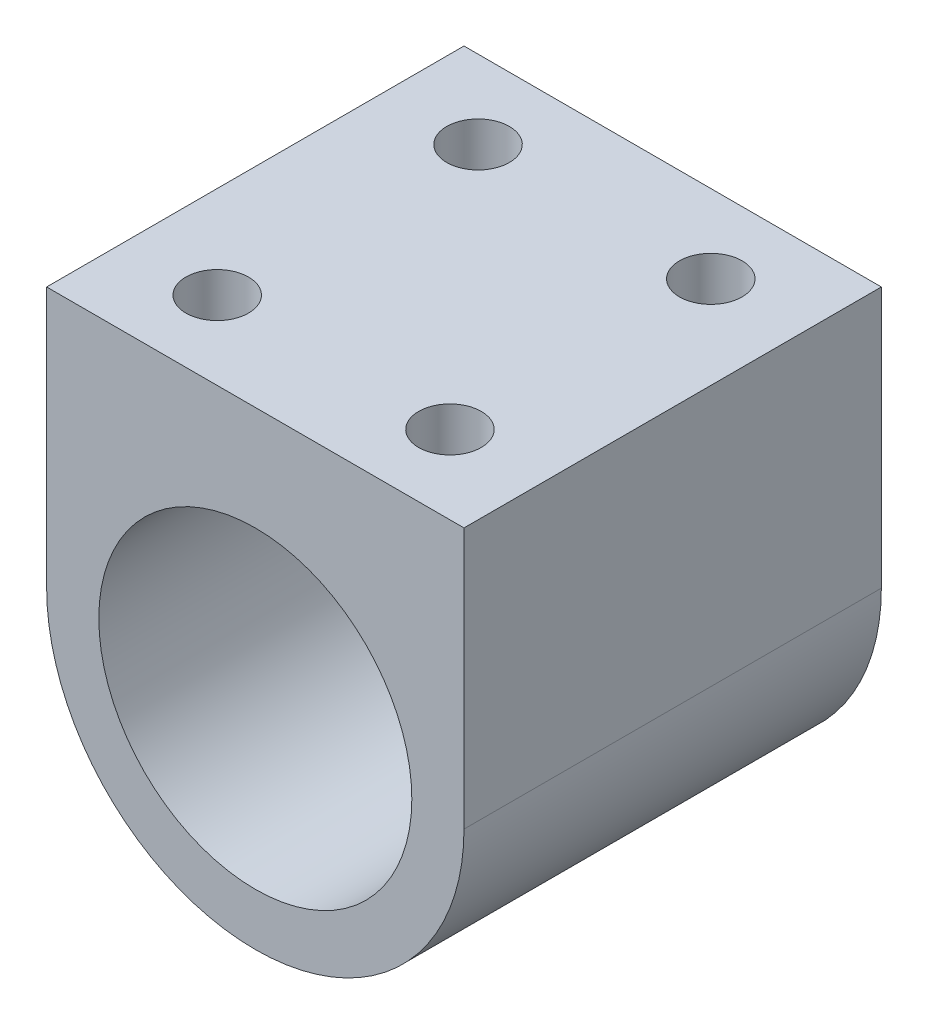
from build123d import *

# Parameters (mm, degrees)
EXTRUDE_1_DEPTH     = 40
SKETCH_2_R          = 15
CUT_EXTRUDE_1_DEPTH = 35
SKETCH_3_R          = 3
CUT_EXTRUDE_2_DEPTH = 12


with BuildPart() as part:
    # 草图1 → 凸台-拉伸1 (new body)
    with BuildSketch(Plane.XY):
        with BuildLine():
            Line((20, 25), (-20, 25))
            Line((-20, 25), (-20, 0))
            ThreePointArc((-20, 0), (0, -20), (20, 0))
            Line((20, 0), (20, 25))
        make_face()
    extrude(amount=EXTRUDE_1_DEPTH)

    # 草图2 → 切除-拉伸1 (cut)
    with BuildSketch(Plane.XY.offset(40)):
        Circle(SKETCH_2_R)
    extrude(amount=-CUT_EXTRUDE_1_DEPTH, mode=Mode.SUBTRACT)

    # 草图3 → 切除-拉伸2 (cut)
    with BuildSketch(Plane(origin=(0, 25, 0), x_dir=(1, 0, 0), z_dir=(0, 1, 0))):
        with Locations(Location((11.153964198, -7.5, 0), (0, 0, 270))):
            Circle(SKETCH_3_R)
        with Locations(Location((-11.153964198, -7.5, 0), (0, 0, 90))):
            Circle(SKETCH_3_R)
        with Locations(Location((11.153964198, -32.5, 0), (0, 0, 270))):
            Circle(SKETCH_3_R)
        with Locations(Location((-11.153964198, -32.5, 0), (0, 0, 90))):
            Circle(SKETCH_3_R)
    extrude(amount=-CUT_EXTRUDE_2_DEPTH, mode=Mode.SUBTRACT)


solid = part.part
